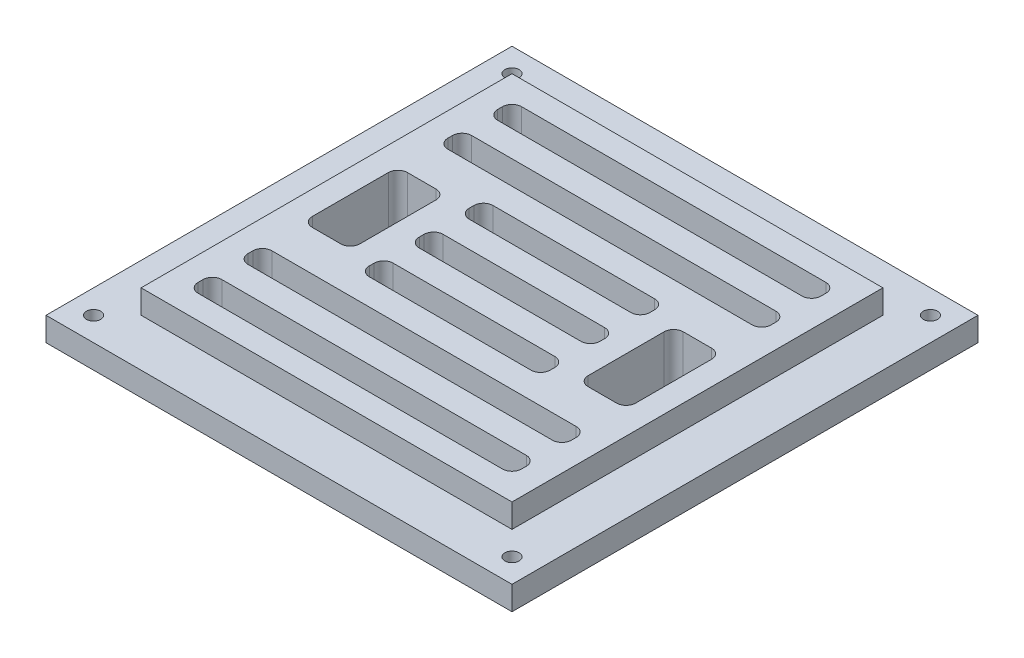
from build123d import *

# Parameters (mm, degrees)
SKETCH1_W           = 98
SKETCH1_H           = 98
BOSS_EXTRUDE1_DEPTH = 10
SKETCH8_W           = 98
SKETCH8_H           = 98
SKETCH8_W_2         = 78
SKETCH8_H_2         = 78
CUT_EXTRUDE5_DEPTH  = 5
SKETCH14_R          = 1.5
CUT_EXTRUDE11_DEPTH = 10
SKETCH15_W          = 10
SKETCH15_H          = 20
CUT_EXTRUDE19_DEPTH = 10
FILLET1_R           = 2


with BuildPart() as part:
    # Sketch1 → Boss-Extrude1 (new body)
    with BuildSketch(Plane(origin=(0, 0, 0), x_dir=(1, 0, 0), z_dir=(0, 1, 0))):
        Rectangle(SKETCH1_W, SKETCH1_H)
    extrude(amount=BOSS_EXTRUDE1_DEPTH)

    # Sketch8 → Cut-Extrude5 (cut)
    with BuildSketch(Plane(origin=(0, 10, 0), x_dir=(1, 0, 0), z_dir=(0, 1, 0))):
        Rectangle(SKETCH8_W, SKETCH8_H)
        Rectangle(SKETCH8_W_2, SKETCH8_H_2, mode=Mode.SUBTRACT)
    extrude(amount=-CUT_EXTRUDE5_DEPTH, mode=Mode.SUBTRACT)

    # Sketch14 → Cut-Extrude11 (cut)
    with BuildSketch(Plane.XZ):
        with Locations(Location((-44, -44, 0), (0, 0, 270))):
            Circle(SKETCH14_R)
        with Locations(Location((-44, 44, 0), (0, 0, 270))):
            Circle(SKETCH14_R)
        with Locations(Location((44, 44, 0), (0, 0, 270))):
            Circle(SKETCH14_R)
        with Locations(Location((44, -44, 0), (0, 0, 270))):
            Circle(SKETCH14_R)
    extrude(amount=-CUT_EXTRUDE11_DEPTH, mode=Mode.SUBTRACT)

    # Sketch15 → Cut-Extrude19 (cut)
    with BuildSketch(Plane(origin=(0, 10, 0), x_dir=(1, 0, 0), z_dir=(0, 1, 0))):
        with BuildLine():
            ThreePointArc((-34, 32), (-33.414213562, 33.414213562), (-32, 34))
            Line((-32, 34), (32, 34))
            ThreePointArc((32, 34), (33.414213562, 33.414213562), (34, 32))
            Line((34, 32), (34, 31))
            ThreePointArc((34, 31), (33.414213562, 29.585786438), (32, 29))
            Line((32, 29), (14, 29))
            Line((14, 29), (-14, 29))
            Line((-14, 29), (-32, 29))
            ThreePointArc((-32, 29), (-33.414213562, 29.585786438), (-34, 31))
            Line((-34, 31), (-34, 32))
        make_face()
        with BuildLine():
            ThreePointArc((-34, 21.5), (-33.414213562, 22.914213562), (-32, 23.5))
            Line((-32, 23.5), (-14, 23.5))
            Line((-14, 23.5), (14, 23.5))
            Line((14, 23.5), (32, 23.5))
            ThreePointArc((32, 23.5), (33.414213562, 22.914213562), (34, 21.5))
            Line((34, 21.5), (34, 20.5))
            ThreePointArc((34, 20.5), (33.414213562, 19.085786438), (32, 18.5))
            Line((32, 18.5), (14, 18.5))
            Line((14, 18.5), (-14, 18.5))
            Line((-14, 18.5), (-32, 18.5))
            ThreePointArc((-32, 18.5), (-33.414213562, 19.085786438), (-34, 20.5))
            Line((-34, 20.5), (-34, 21.5))
        make_face()
        with BuildLine():
            ThreePointArc((-19, 11), (-18.414213562, 12.414213562), (-17, 13))
            Line((-17, 13), (-14, 13))
            Line((-14, 13), (14, 13))
            Line((14, 13), (17, 13))
            ThreePointArc((17, 13), (18.414213562, 12.414213562), (19, 11))
            Line((19, 11), (19, 10))
            ThreePointArc((19, 10), (18.414213562, 8.585786438), (17, 8))
            Line((17, 8), (14, 8))
            Line((14, 8), (-14, 8))
            Line((-14, 8), (-17, 8))
            ThreePointArc((-17, 8), (-18.414213562, 8.585786438), (-19, 10))
            Line((-19, 10), (-19, 11))
        make_face()
        with BuildLine():
            ThreePointArc((-19, 0.5), (-18.414213562, 1.914213562), (-17, 2.5))
            Line((-17, 2.5), (-14, 2.5))
            Line((-14, 2.5), (14, 2.5))
            Line((14, 2.5), (17, 2.5))
            ThreePointArc((17, 2.5), (18.414213562, 1.914213562), (19, 0.5))
            Line((19, 0.5), (19, -0.5))
            ThreePointArc((19, -0.5), (18.414213562, -1.914213562), (17, -2.5))
            Line((17, -2.5), (14, -2.5))
            Line((14, -2.5), (-14, -2.5))
            Line((-14, -2.5), (-17, -2.5))
            ThreePointArc((-17, -2.5), (-18.414213562, -1.914213562), (-19, -0.5))
            Line((-19, -0.5), (-19, 0.5))
        make_face()
        with BuildLine():
            ThreePointArc((-19, -10), (-18.414213562, -8.585786438), (-17, -8))
            Line((-17, -8), (-14, -8))
            Line((-14, -8), (14, -8))
            Line((14, -8), (17, -8))
            ThreePointArc((17, -8), (18.414213562, -8.585786438), (19, -10))
            Line((19, -10), (19, -11))
            ThreePointArc((19, -11), (18.414213562, -12.414213562), (17, -13))
            Line((17, -13), (14, -13))
            Line((14, -13), (-14, -13))
            Line((-14, -13), (-17, -13))
            ThreePointArc((-17, -13), (-18.414213562, -12.414213562), (-19, -11))
            Line((-19, -11), (-19, -10))
        make_face()
        with BuildLine():
            ThreePointArc((32, -18.5), (33.414213562, -19.085786438), (34, -20.5))
            Line((34, -20.5), (34, -21.5))
            ThreePointArc((34, -21.5), (33.414213562, -22.914213562), (32, -23.5))
            Line((32, -23.5), (14, -23.5))
            Line((14, -23.5), (-14, -23.5))
            Line((-14, -23.5), (-32, -23.5))
            ThreePointArc((-32, -23.5), (-33.414213562, -22.914213562), (-34, -21.5))
            Line((-34, -21.5), (-34, -20.5))
            ThreePointArc((-34, -20.5), (-33.414213562, -19.085786438), (-32, -18.5))
            Line((-32, -18.5), (-14, -18.5))
            Line((-14, -18.5), (14, -18.5))
            Line((14, -18.5), (32, -18.5))
        make_face()
        with BuildLine():
            ThreePointArc((32, -29), (33.414213562, -29.585786438), (34, -31))
            Line((34, -31), (34, -32))
            ThreePointArc((34, -32), (33.414213562, -33.414213562), (32, -34))
            Line((32, -34), (-32, -34))
            ThreePointArc((-32, -34), (-33.414213562, -33.414213562), (-34, -32))
            Line((-34, -32), (-34, -31))
            ThreePointArc((-34, -31), (-33.414213562, -29.585786438), (-32, -29))
            Line((-32, -29), (-14, -29))
            Line((-14, -29), (14, -29))
            Line((14, -29), (32, -29))
        make_face()
        with Locations((-29, 0)):
            Rectangle(SKETCH15_W, SKETCH15_H)
        with Locations((29, 0)):
            Rectangle(SKETCH15_W, SKETCH15_H)
    extrude(amount=-CUT_EXTRUDE19_DEPTH, mode=Mode.SUBTRACT)

    # Fillet1
    fillet1_edges = [part.edges().sort_by_distance(p)[0] for p in [
        (34, 5, -10),
        (34, 5, 10),
        (24, 5, 10),
        (24, 5, -10),
        (-34, 5, -10),
        (-24, 5, -10),
        (-24, 5, 10),
        (-34, 5, 10),
    ]]
    fillet(fillet1_edges, radius=FILLET1_R)


solid = part.part
